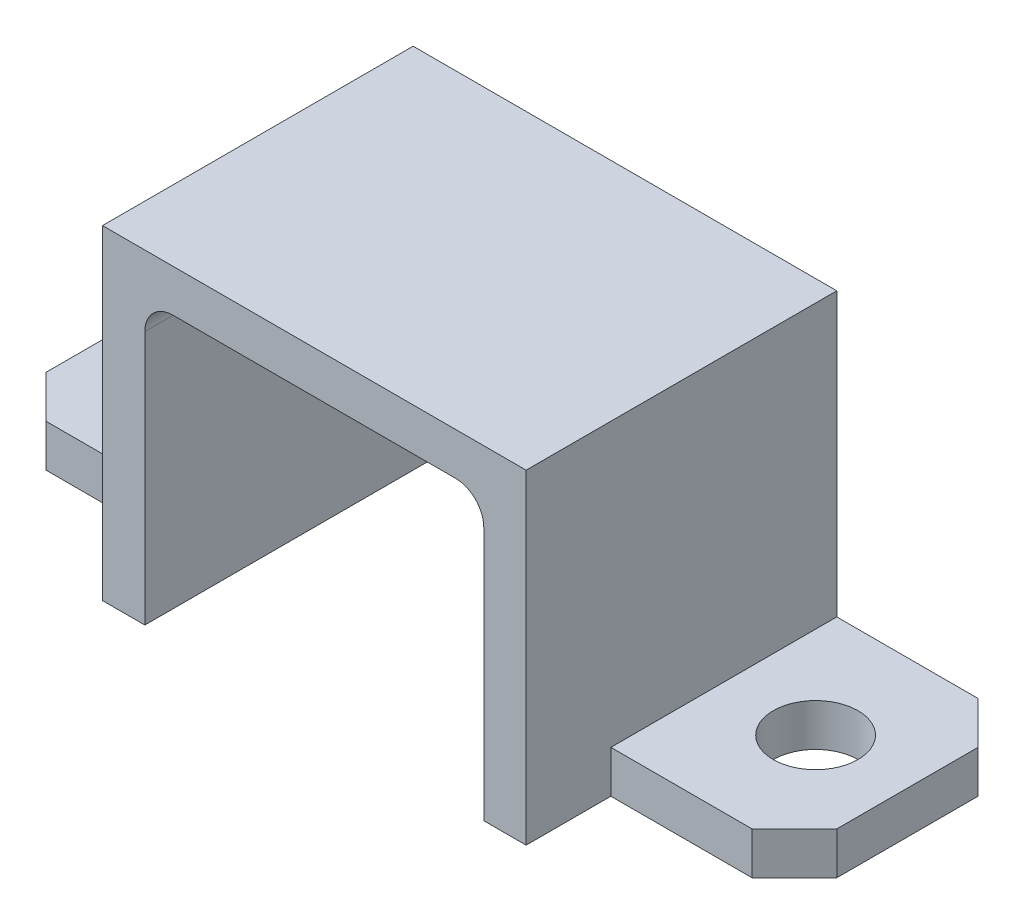
from build123d import *

# Parameters (mm, degrees)
BOSS_EXTRUDE1_DEPTH = 11
SKETCH3_W           = 6.5
SKETCH3_H           = 1.5
CUT_EXTRUDE5_DEPTH  = 3
SKETCH6_R           = 1.5
CUT_EXTRUDE7_DEPTH  = 27.551836095


with BuildPart() as part:
    # Sketch1 → Boss-Extrude1 (new body)
    with BuildSketch(Plane.XY):
        with BuildLine():
            Line((0.5, 1.5), (0.5, 11.5))
            Line((0.5, 11.5), (15.5, 11.5))
            Line((15.5, 11.5), (15.5, 1.5))
            Line((15.5, 1.5), (22, 1.5))
            Line((22, 1.5), (22, 0))
            Line((22, 0), (14, 0))
            Line((14, 0), (14, 9))
            ThreePointArc((14, 9), (13.707106781, 9.707106781), (13, 10))
            Line((13, 10), (3, 10))
            ThreePointArc((3, 10), (2.292893219, 9.707106781), (2, 9))
            Line((2, 9), (2, 0))
            Line((2, 0), (-6, 0))
            Line((-6, 0), (-6, 1.5))
            Line((-6, 1.5), (0.5, 1.5))
        make_face()
    extrude(amount=BOSS_EXTRUDE1_DEPTH)

    # Sketch3 → Cut-Extrude5 (cut)
    with BuildSketch(Plane.XY.offset(11)):
        with Locations((-2.75, 0.75)):
            Rectangle(SKETCH3_W, SKETCH3_H)
        with Locations((18.75, 0.75)):
            Rectangle(SKETCH3_W, SKETCH3_H)
    extrude(amount=-CUT_EXTRUDE5_DEPTH, mode=Mode.SUBTRACT)

    # Sketch6 → Cut-Extrude7 (cut, through all)
    with BuildSketch(Plane(origin=(0, 1.5, 0), x_dir=(1, 0, 0), z_dir=(0, 1, 0))):
        with Locations(Location((-2.75, -4, 0), (0, 0, 180))):
            Circle(SKETCH6_R)
        with Locations((18.75, -4)):
            Circle(SKETCH6_R)
        Polygon((-6, -1.5), (-4.5, 0), (-6, 0), align=None)
        Polygon((20.5, 0), (22, 0), (22, -1.5), align=None)
        Polygon((22, -6.5), (20.5, -8), (22, -8), align=None)
        Polygon((-4.5, -8), (-6, -8), (-6, -6.5), align=None)
    extrude(amount=-CUT_EXTRUDE7_DEPTH, mode=Mode.SUBTRACT)


solid = part.part
